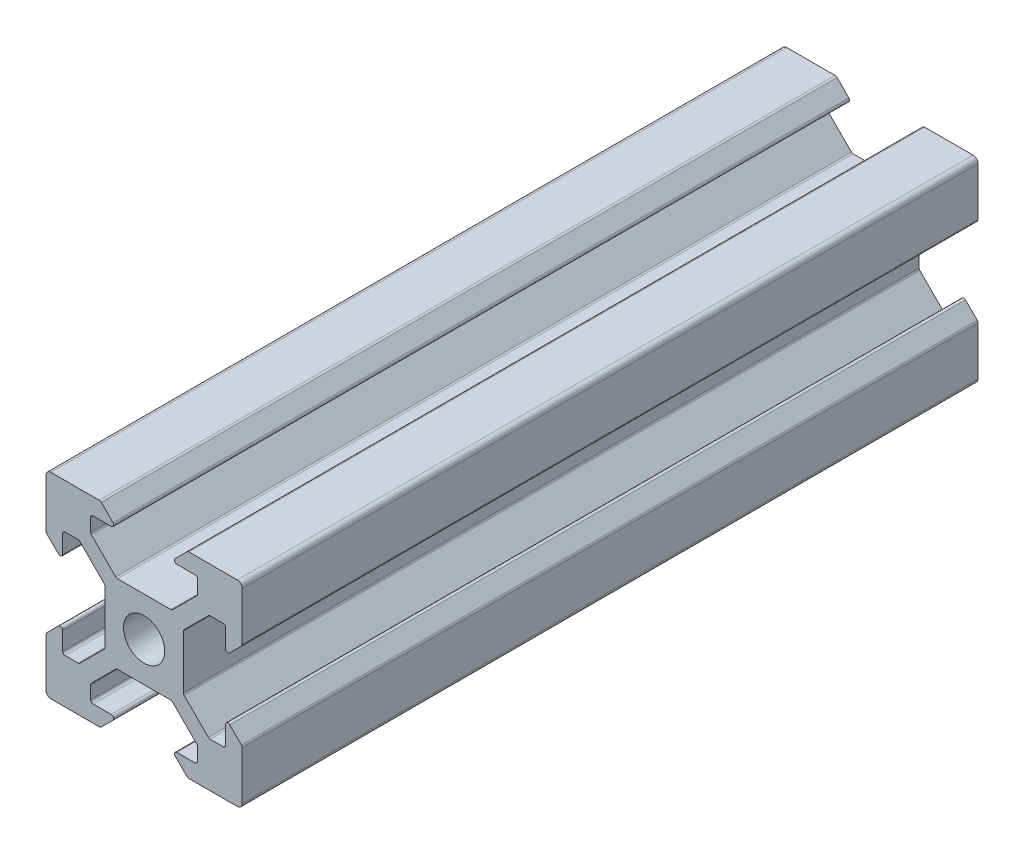
from build123d import *

# Parameters (mm, degrees)
MODEL_R             = 2.1
BOSS_EXTRUDE1_DEPTH = 75


with BuildPart() as part:
    # Model → Boss-Extrude1 (new body)
    with BuildSketch(Plane.XY):
        with BuildLine():
            Line((2012.931211125, 1381.800393717), (2012.931211125, 1378.200393717))
            Line((2012.931211125, 1378.200393717), (2012.931211125, 1377.300429431))
            ThreePointArc((2012.931211125, 1377.300429431), (2012.908374985, 1377.185624401), (2012.843343159, 1377.088297396))
            Line((2012.843343159, 1377.088297396), (2010.378662785, 1374.623617022))
            ThreePointArc((2010.378662785, 1374.623617022), (2010.297556948, 1374.569423834), (2010.20188609, 1374.550393717))
            Line((2010.20188609, 1374.550393717), (2008.881211125, 1374.550393717))
            ThreePointArc((2008.881211125, 1374.550393717), (2008.70443443, 1374.623617022), (2008.631211125, 1374.800393717))
            Line((2008.631211125, 1374.800393717), (2008.631211125, 1376.650393717))
            ThreePointArc((2008.631211125, 1376.650393717), (2008.476881983, 1376.8813636), (2008.20443443, 1376.827170412))
            Line((2008.20443443, 1376.827170412), (2007.01907909, 1375.641815073))
            ThreePointArc((2007.01907909, 1375.641815073), (2006.954047265, 1375.544488069), (2006.931211125, 1375.429683039))
            Line((2006.931211125, 1375.429683039), (2006.931211125, 1370.500393717))
            ThreePointArc((2006.931211125, 1370.500393717), (2007.077657734, 1370.146840327), (2007.431211125, 1370.000393717))
            Line((2007.431211125, 1370.000393717), (2012.360500447, 1370.000393717))
            ThreePointArc((2012.360500447, 1370.000393717), (2012.475305476, 1370.023229857), (2012.572632481, 1370.088261683))
            Line((2012.572632481, 1370.088261683), (2013.75798782, 1371.273617022))
            ThreePointArc((2013.75798782, 1371.273617022), (2013.812181008, 1371.546064575), (2013.581211125, 1371.700393717))
            Line((2013.581211125, 1371.700393717), (2011.731211125, 1371.700393717))
            ThreePointArc((2011.731211125, 1371.700393717), (2011.55443443, 1371.773617022), (2011.481211125, 1371.950393717))
            Line((2011.481211125, 1371.950393717), (2011.481211125, 1373.271068682))
            ThreePointArc((2011.481211125, 1373.271068682), (2011.500241242, 1373.36673954), (2011.55443443, 1373.447845377))
            Line((2011.55443443, 1373.447845377), (2014.033759465, 1375.927170412))
            ThreePointArc((2014.033759465, 1375.927170412), (2014.114865302, 1375.9813636), (2014.21053616, 1376.000393717))
            Line((2014.21053616, 1376.000393717), (2016.470233902, 1376.000393717))
            Line((2016.470233902, 1376.000393717), (2017.392188348, 1376.000393717))
            Line((2017.392188348, 1376.000393717), (2019.65188609, 1376.000393717))
            ThreePointArc((2019.65188609, 1376.000393717), (2019.747556948, 1375.9813636), (2019.828662785, 1375.927170412))
            Line((2019.828662785, 1375.927170412), (2022.30798782, 1373.447845377))
            ThreePointArc((2022.30798782, 1373.447845377), (2022.362181008, 1373.36673954), (2022.381211125, 1373.271068682))
            Line((2022.381211125, 1373.271068682), (2022.381211125, 1371.950393717))
            ThreePointArc((2022.381211125, 1371.950393717), (2022.30798782, 1371.773617022), (2022.131211125, 1371.700393717))
            Line((2022.131211125, 1371.700393717), (2020.281211125, 1371.700393717))
            ThreePointArc((2020.281211125, 1371.700393717), (2020.050241242, 1371.546064575), (2020.10443443, 1371.273617022))
            Line((2020.10443443, 1371.273617022), (2021.289789769, 1370.088261683))
            ThreePointArc((2021.289789769, 1370.088261683), (2021.387116773, 1370.023229857), (2021.501921803, 1370.000393717))
            Line((2021.501921803, 1370.000393717), (2026.431211125, 1370.000393717))
            ThreePointArc((2026.431211125, 1370.000393717), (2026.784764515, 1370.146840327), (2026.931211125, 1370.500393717))
            Line((2026.931211125, 1370.500393717), (2026.931211125, 1375.429683039))
            ThreePointArc((2026.931211125, 1375.429683039), (2026.908374985, 1375.544488069), (2026.843343159, 1375.641815073))
            Line((2026.843343159, 1375.641815073), (2025.65798782, 1376.827170412))
            ThreePointArc((2025.65798782, 1376.827170412), (2025.385540267, 1376.8813636), (2025.231211125, 1376.650393717))
            Line((2025.231211125, 1376.650393717), (2025.231211125, 1374.800393717))
            ThreePointArc((2025.231211125, 1374.800393717), (2025.15798782, 1374.623617022), (2024.981211125, 1374.550393717))
            Line((2024.981211125, 1374.550393717), (2023.66053616, 1374.550393717))
            ThreePointArc((2023.66053616, 1374.550393717), (2023.564865302, 1374.569423834), (2023.483759465, 1374.623617022))
            Line((2023.483759465, 1374.623617022), (2021.00443443, 1377.102942057))
            ThreePointArc((2021.00443443, 1377.102942057), (2020.950241242, 1377.184047894), (2020.931211125, 1377.279718752))
            Line((2020.931211125, 1377.279718752), (2020.931211125, 1379.539416494))
            Line((2020.931211125, 1379.539416494), (2020.931211125, 1380.46137094))
            Line((2020.931211125, 1380.46137094), (2020.931211125, 1382.721068682))
            ThreePointArc((2020.931211125, 1382.721068682), (2020.950241242, 1382.81673954), (2021.00443443, 1382.897845377))
            Line((2021.00443443, 1382.897845377), (2023.483759465, 1385.377170412))
            ThreePointArc((2023.483759465, 1385.377170412), (2023.564865302, 1385.4313636), (2023.66053616, 1385.450393717))
            Line((2023.66053616, 1385.450393717), (2024.981211125, 1385.450393717))
            ThreePointArc((2024.981211125, 1385.450393717), (2025.15798782, 1385.377170412), (2025.231211125, 1385.200393717))
            Line((2025.231211125, 1385.200393717), (2025.231211125, 1383.350393717))
            ThreePointArc((2025.231211125, 1383.350393717), (2025.385540267, 1383.119423834), (2025.65798782, 1383.173617022))
            Line((2025.65798782, 1383.173617022), (2026.843343159, 1384.358972361))
            ThreePointArc((2026.843343159, 1384.358972361), (2026.908374985, 1384.456299366), (2026.931211125, 1384.571104395))
            Line((2026.931211125, 1384.571104395), (2026.931211125, 1389.500393717))
            ThreePointArc((2026.931211125, 1389.500393717), (2026.784764516, 1389.853947108), (2026.431211125, 1390.000393717))
            Line((2026.431211125, 1390.000393717), (2021.501921803, 1390.000393717))
            ThreePointArc((2021.501921803, 1390.000393717), (2021.387116773, 1389.977557577), (2021.289789769, 1389.912525752))
            Line((2021.289789769, 1389.912525752), (2020.10443443, 1388.727170413))
            ThreePointArc((2020.10443443, 1388.727170413), (2020.050241242, 1388.454722859), (2020.281211125, 1388.300393717))
            Line((2020.281211125, 1388.300393717), (2022.131211125, 1388.300393717))
            ThreePointArc((2022.131211125, 1388.300393717), (2022.30798782, 1388.227170413), (2022.381211125, 1388.050393717))
            Line((2022.381211125, 1388.050393717), (2022.381211125, 1386.729718752))
            ThreePointArc((2022.381211125, 1386.729718752), (2022.362181008, 1386.634047894), (2022.30798782, 1386.552942057))
            Line((2022.30798782, 1386.552942057), (2019.828662785, 1384.073617022))
            ThreePointArc((2019.828662785, 1384.073617022), (2019.747556948, 1384.019423834), (2019.65188609, 1384.000393717))
            Line((2019.65188609, 1384.000393717), (2017.392188348, 1384.000393717))
            Line((2017.392188348, 1384.000393717), (2016.470233902, 1384.000393717))
            Line((2016.470233902, 1384.000393717), (2014.21053616, 1384.000393717))
            ThreePointArc((2014.21053616, 1384.000393717), (2014.114865302, 1384.019423834), (2014.033759465, 1384.073617022))
            Line((2014.033759465, 1384.073617022), (2011.55443443, 1386.552942057))
            ThreePointArc((2011.55443443, 1386.552942057), (2011.500241242, 1386.634047894), (2011.481211125, 1386.729718752))
            Line((2011.481211125, 1386.729718752), (2011.481211125, 1388.050393717))
            ThreePointArc((2011.481211125, 1388.050393717), (2011.55443443, 1388.227170413), (2011.731211125, 1388.300393717))
            Line((2011.731211125, 1388.300393717), (2013.581211125, 1388.300393717))
            ThreePointArc((2013.581211125, 1388.300393717), (2013.812181008, 1388.454722859), (2013.75798782, 1388.727170413))
            Line((2013.75798782, 1388.727170413), (2012.572632481, 1389.912525752))
            ThreePointArc((2012.572632481, 1389.912525752), (2012.475305477, 1389.977557577), (2012.360500447, 1390.000393717))
            Line((2012.360500447, 1390.000393717), (2007.431211125, 1390.000393717))
            ThreePointArc((2007.431211125, 1390.000393717), (2007.077657734, 1389.853947108), (2006.931211125, 1389.500393717))
            Line((2006.931211125, 1389.500393717), (2006.931211125, 1384.571104395))
            ThreePointArc((2006.931211125, 1384.571104395), (2006.954047265, 1384.456299366), (2007.019079091, 1384.358972361))
            Line((2007.019079091, 1384.358972361), (2008.20443443, 1383.173617022))
            ThreePointArc((2008.20443443, 1383.173617022), (2008.476881983, 1383.119423834), (2008.631211125, 1383.350393717))
            Line((2008.631211125, 1383.350393717), (2008.631211125, 1385.200393717))
            ThreePointArc((2008.631211125, 1385.200393717), (2008.70443443, 1385.377170412), (2008.881211125, 1385.450393717))
            Line((2008.881211125, 1385.450393717), (2010.20188609, 1385.450393717))
            ThreePointArc((2010.20188609, 1385.450393717), (2010.297556948, 1385.4313636), (2010.378662785, 1385.377170412))
            Line((2010.378662785, 1385.377170412), (2012.843343159, 1382.912490038))
            ThreePointArc((2012.843343159, 1382.912490038), (2012.908374985, 1382.815163033), (2012.931211125, 1382.700358004))
            Line((2012.931211125, 1382.700358004), (2012.931211125, 1381.800393717))
        make_face()
        with Locations((2016.931211125, 1380.000393717)):
            Circle(MODEL_R, mode=Mode.SUBTRACT)
    extrude(amount=BOSS_EXTRUDE1_DEPTH)


solid = part.part
